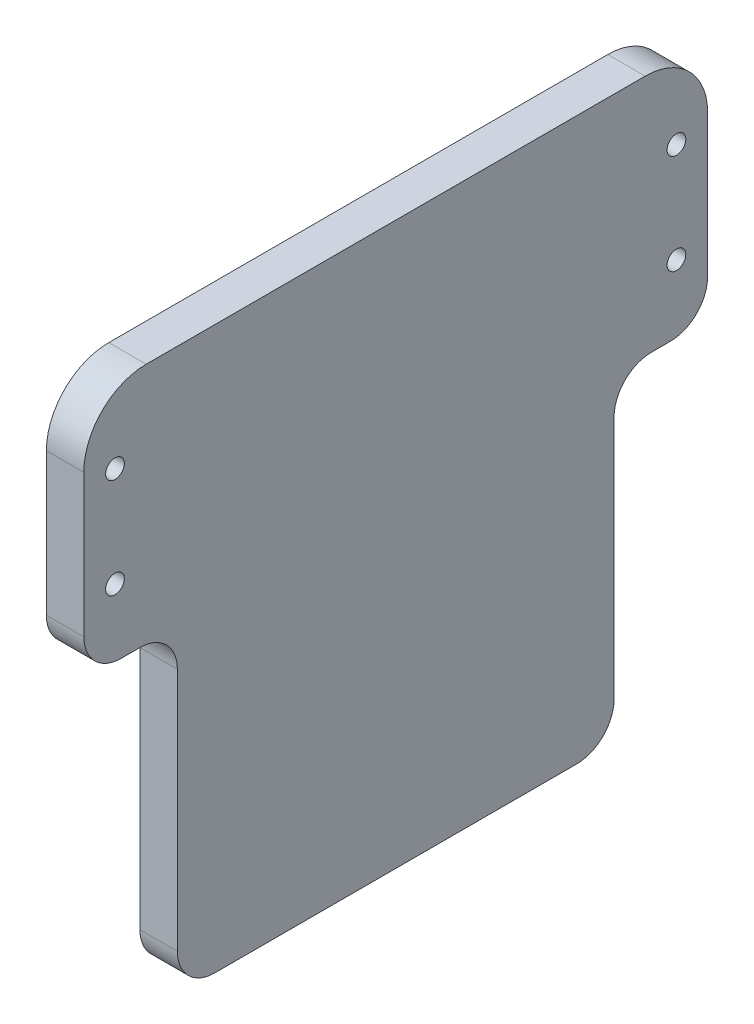
from build123d import *

# Parameters (mm, degrees)
BOSS_EXTRUDE1_DEPTH = 3
SKETCH2_R           = 0.75
CUT_EXTRUDE1_DEPTH  = 146.674630793
CUT_EXTRUDE2_DEPTH  = 10
FILLET1_R           = 5
FILLET2_R           = 5


with BuildPart() as part:
    # Sketch1 → Boss-Extrude1 (new body)
    with BuildSketch(Plane(origin=(0, 0, 0), x_dir=(0, 0, -1), z_dir=(1, 0, 0))):
        with BuildLine():
            Line((-30, -97.52051802), (-30, -109.52051802))
            ThreePointArc((-30, -109.52051802), (-27.656854249, -115.177372269), (-22, -117.52051802))
            Line((-22, -117.52051802), (-21.5, -117.52051802))
            ThreePointArc((-21.5, -117.52051802), (-18.671572875, -118.692090895), (-17.5, -121.52051802))
            Line((-17.5, -121.52051802), (-17.5, -139.52051802))
            ThreePointArc((-17.5, -139.52051802), (-16.621320344, -141.641838363), (-14.5, -142.52051802))
            Line((-14.5, -142.52051802), (14.5, -142.52051802))
            ThreePointArc((14.5, -142.52051802), (16.621320344, -141.641838363), (17.5, -139.52051802))
            Line((17.5, -139.52051802), (17.5, -121.52051802))
            ThreePointArc((17.5, -121.52051802), (18.671572875, -118.692090895), (21.5, -117.52051802))
            Line((21.5, -117.52051802), (22, -117.52051802))
            ThreePointArc((22, -117.52051802), (27.656854249, -115.177372269), (30, -109.52051802))
            Line((30, -109.52051802), (30, -97.52051802))
            Line((30, -97.52051802), (-30, -97.52051802))
        make_face()
    extrude(amount=BOSS_EXTRUDE1_DEPTH)

    # Sketch2 → Cut-Extrude1 (cut, through all)
    with BuildSketch(Plane(origin=(3, 0, 0), x_dir=(0, 0, -1), z_dir=(1, 0, 0))):
        with Locations((-22.5, -103.52051802)):
            Circle(SKETCH2_R)
        with Locations(Location((-22.5, -111.52051802, 0), (0, 0, 180))):
            Circle(SKETCH2_R)
        with Locations((22.5, -111.52051802)):
            Circle(SKETCH2_R)
        with Locations(Location((22.5, -103.52051802, 0), (0, 0, 180))):
            Circle(SKETCH2_R)
    extrude(amount=-CUT_EXTRUDE1_DEPTH, mode=Mode.SUBTRACT)

    # Sketch3 → Cut-Extrude2 (cut)
    with BuildSketch(Plane(origin=(3, 0, 0), x_dir=(0, 0, -1), z_dir=(1, 0, 0))):
        with BuildLine():
            Line((-30, -97.52051802), (-25, -97.52051802))
            Line((-25, -97.52051802), (-25, -113.936716507))
            ThreePointArc((-25, -113.936716507), (-24.121320344, -116.05803685), (-22, -116.936716507))
            Line((-22, -116.936716507), (-20.5, -116.936716507))
            ThreePointArc((-20.5, -116.936716507), (-18.378679656, -117.815396163), (-17.5, -119.936716507))
            Line((-17.5, -119.936716507), (-17.5, -122.452918804))
            Line((-17.5, -122.452918804), (-42.892449252, -122.452918804))
            Line((-42.892449252, -122.452918804), (-42.892449252, -97.52051802))
            Line((-42.892449252, -97.52051802), (-30, -97.52051802))
        make_face()
        with BuildLine():
            Line((20.5, -116.936716507), (22, -116.936716507))
            ThreePointArc((22, -116.936716507), (24.121320344, -116.05803685), (25, -113.936716507))
            Line((25, -113.936716507), (25, -97.52051802))
            Line((25, -97.52051802), (30, -97.52051802))
            Line((30, -97.52051802), (42.892449252, -97.52051802))
            Line((42.892449252, -97.52051802), (42.892449252, -122.452918804))
            Line((42.892449252, -122.452918804), (17.5, -122.452918804))
            Line((17.5, -122.452918804), (17.5, -119.936716507))
            ThreePointArc((17.5, -119.936716507), (18.378679656, -117.815396163), (20.5, -116.936716507))
        make_face()
    extrude(amount=-CUT_EXTRUDE2_DEPTH, mode=Mode.SUBTRACT)

    # Fillet1
    fillet1_edges = [part.edges().sort_by_distance(p)[0] for p in [
        (1.5, -97.52051802, 25),
    ]]
    fillet(fillet1_edges, radius=FILLET1_R)

    # Fillet2
    fillet2_edges = [part.edges().sort_by_distance(p)[0] for p in [
        (1.5, -97.52051802, -25),
    ]]
    fillet(fillet2_edges, radius=FILLET2_R)


solid = part.part
